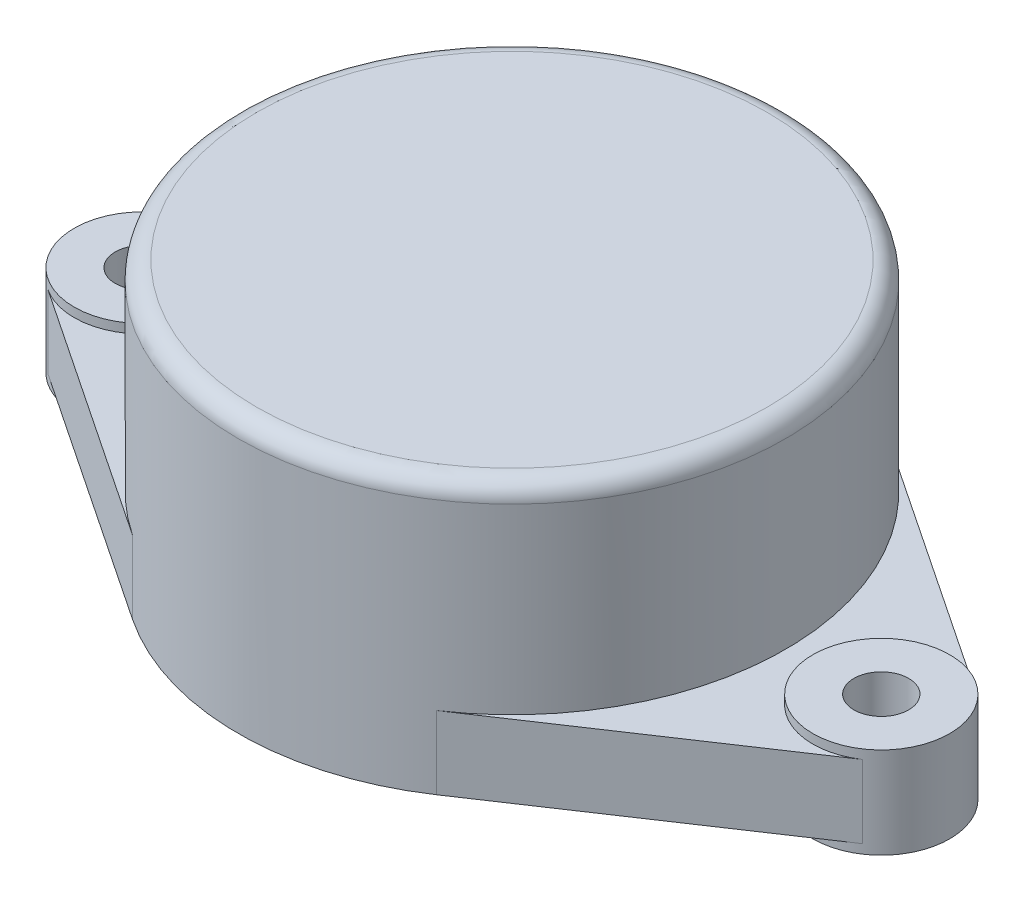
from build123d import *

# Parameters (mm, degrees)
SKETCH1_R                = 15
BOSS_EXTRUDE1_DEPTH      = 15
SKETCH2_R                = 1.5
BOSS_EXTRUDE2_DEPTH      = 4
BOSS_EXTRUDE3_DEPTH      = 0.5
BOSS_EXTRUDE3_DEPTH_BACK = 4.5
SKETCH3_R                = 3.75
SKETCH3_R_2              = 1.5
FILLET1_R                = 1


with BuildPart() as part:
    # Sketch1 → Boss-Extrude1 (new body)
    with BuildSketch(Plane(origin=(0, 0, 0), x_dir=(1, 0, 0), z_dir=(0, 1, 0))):
        with Locations(Location((0, 0, 0), (0, 0, 270))):
            Circle(SKETCH1_R)
    extrude(amount=BOSS_EXTRUDE1_DEPTH)

    # Sketch2 → Boss-Extrude2 (add)
    # profile 1 of 2: a face of its own
    with BuildSketch(Plane(origin=(0, 0, 0), x_dir=(1, 0, 0), z_dir=(0, 1, 0))):
        with BuildLine():
            ThreePointArc((-8.333333333, 12.472191289), (-15, 0), (-8.333333333, -12.472191289))
            Line((-8.333333333, -12.472191289), (-22.333333333, -3.118047822))
            ThreePointArc((-22.333333333, -3.118047822), (-24, 0), (-22.333333333, 3.118047822))
            Line((-22.333333333, 3.118047822), (-8.333333333, 12.472191289))
        make_face()
        with Locations(Location((-20.25, 0, 0), (0, 0, 270))):
            Circle(SKETCH2_R, mode=Mode.SUBTRACT)
    # profile 2 of 2: a face of its own
    with BuildSketch(Plane(origin=(0, 0, 0), x_dir=(1, 0, 0), z_dir=(0, 1, 0))):
        with BuildLine():
            Line((8.333333333, 12.472191289), (22.333333333, 3.118047822))
            ThreePointArc((22.333333333, 3.118047822), (24, 0), (22.333333333, -3.118047822))
            Line((22.333333333, -3.118047822), (8.333333333, -12.472191289))
            ThreePointArc((8.333333333, -12.472191289), (15, 0), (8.333333333, 12.472191289))
        make_face()
        with Locations(Location((20.25, 0, 0), (0, 0, 270))):
            Circle(SKETCH2_R, mode=Mode.SUBTRACT)
    extrude(amount=BOSS_EXTRUDE2_DEPTH)

    # Sketch3 → Boss-Extrude3 (add, two sides: drawn at the far end of the back side and taken through both)
    # profile 1 of 2: a face of its own
    with BuildSketch(Plane(origin=(0, 4, 0), x_dir=(1, 0, 0), z_dir=(0, 1, 0)).offset(-BOSS_EXTRUDE3_DEPTH_BACK)):
        with Locations(Location((-20.25, 0, 0), (0, 0, 270))):
            Circle(SKETCH3_R)
        with Locations(Location((-20.25, 0, 0), (0, 0, 270))):
            Circle(SKETCH3_R_2, mode=Mode.SUBTRACT)
    # profile 2 of 2: a face of its own
    with BuildSketch(Plane(origin=(0, 4, 0), x_dir=(1, 0, 0), z_dir=(0, 1, 0)).offset(-BOSS_EXTRUDE3_DEPTH_BACK)):
        with Locations(Location((20.25, 0, 0), (0, 0, 270))):
            Circle(SKETCH3_R)
        with Locations(Location((20.25, 0, 0), (0, 0, 270))):
            Circle(SKETCH3_R_2, mode=Mode.SUBTRACT)
    extrude(amount=BOSS_EXTRUDE3_DEPTH + BOSS_EXTRUDE3_DEPTH_BACK)

    # Fillet1
    fillet1_edges = [part.edges().sort_by_distance(p)[0] for p in [
        (0, 15, -15),
    ]]
    fillet(fillet1_edges, radius=FILLET1_R)


solid = part.part
